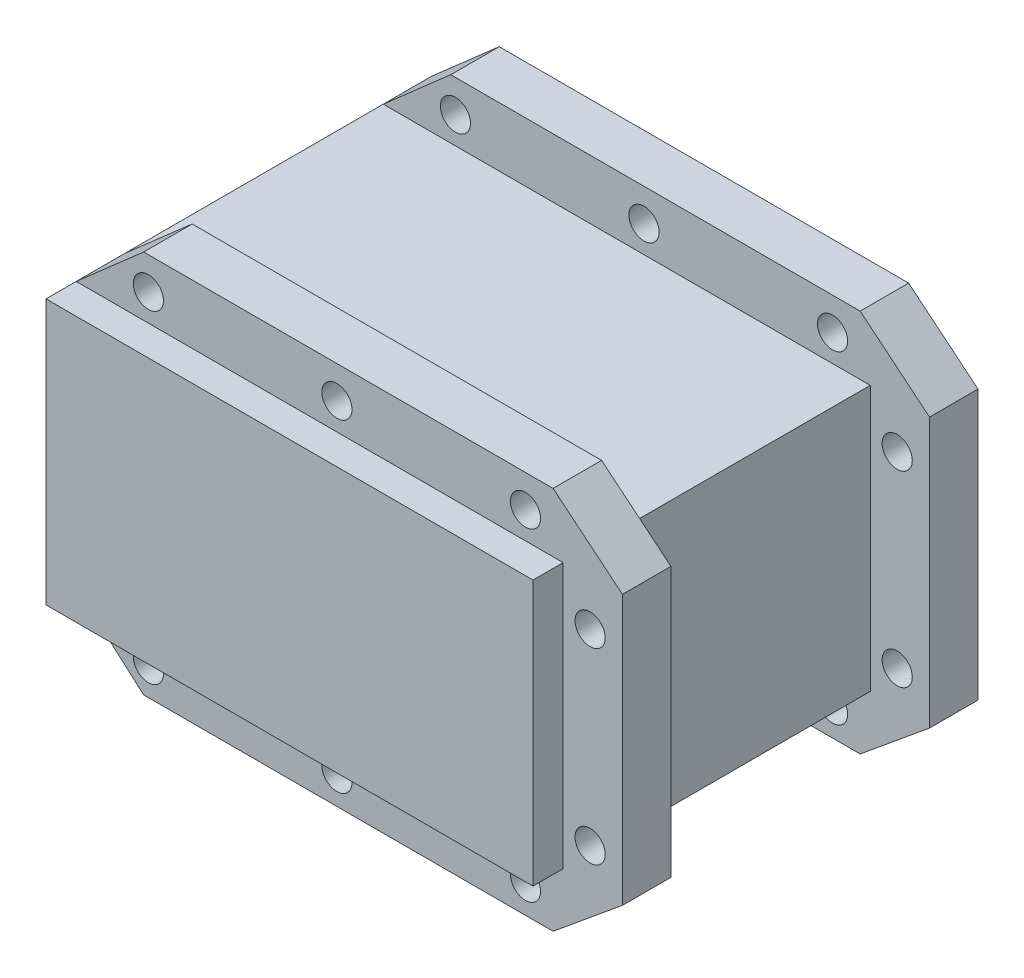
from build123d import *

# Parameters (mm, degrees)
SKETCH1_W                 = 45.2
SKETCH1_H                 = 24.6
BOSS_EXTRUDE1_DEPTH       = 35.8
BOSS_EXTRUDE2_DEPTH       = 4.5
SKETCH4_R                 = 1.4
CUT_EXTRUDE1_DEPTH        = 68.568483778
LPATTERN1_COUNT           = 3
LPATTERN1_PITCH           = 17.5
LPATTERN1_COUNT_DIR2      = 2
LPATTERN1_PITCH_DIR2      = 30
SKETCH6_R                 = 1.4
CUT_EXTRUDE2_DEPTH        = 68.568483778
LPATTERN2_COUNT           = 2
LPATTERN2_PITCH           = 28.5
LPATTERN2_COPY_1_SKETCH_R = 1.4
LPATTERN2_COPY_1_DEPTH    = 68.568483778
LPATTERN2_COPY_2_SKETCH_R = 1.4
LPATTERN2_COPY_2_DEPTH    = 68.568483778
LPATTERN2_COPY_3_SKETCH_R = 1.4
LPATTERN2_COPY_3_DEPTH    = 68.568483778
LPATTERN2_COPY_4_SKETCH_R = 1.4
LPATTERN2_COPY_4_DEPTH    = 68.568483778
LPATTERN2_COPY_5_SKETCH_R = 1.4
LPATTERN2_COPY_5_DEPTH    = 68.568483778


with BuildPart() as part:
    # Sketch1 → Boss-Extrude1 (new body)
    with BuildSketch(Plane.XY):
        with Locations((22.6, 12.3)):
            Rectangle(SKETCH1_W, SKETCH1_H)
    extrude(amount=BOSS_EXTRUDE1_DEPTH)

    # Sketch3 → Boss-Extrude2 (add)
    with BuildSketch(Plane.XY.offset(33)):
        Polygon((0, 24.6), (6.26496063, 30.1), (44.26496063, 30.1), (50.7, 24.8), (50.7, -0.2), (44.26496063, -5.5), (6.26496063, -5.5), (0, 0), (45.2, 0), (45.2, 24.6), align=None)
    boss_extrude2 = extrude(amount=-BOSS_EXTRUDE2_DEPTH)

    # Sketch4 → Cut-Extrude1 (cut, through all)
    with BuildSketch(Plane.XY.offset(33)):
        with Locations((6.7, 27.1)):
            Circle(SKETCH4_R)
    cut_extrude1 = extrude(amount=-CUT_EXTRUDE1_DEPTH, mode=Mode.SUBTRACT)

    # LPattern1: Cut-Extrude1 3 × 2
    with Locations(*[(i * LPATTERN1_PITCH, -j * LPATTERN1_PITCH_DIR2, 0) for i in range(LPATTERN1_COUNT) for j in range(LPATTERN1_COUNT_DIR2) if (i, j) != (0, 0)]):
        add(cut_extrude1, mode=Mode.SUBTRACT)

    # Sketch6 → Cut-Extrude2 (cut, through all)
    with BuildSketch(Plane.XY.offset(33)):
        with Locations((47.7, 20.5)):
            Circle(SKETCH6_R)
        with Locations((47.7, 3.1)):
            Circle(SKETCH6_R)
    cut_extrude2 = extrude(amount=-CUT_EXTRUDE2_DEPTH, mode=Mode.SUBTRACT)

    # LPattern2: Boss-Extrude2, Cut-Extrude1, Cut-Extrude2 ×2
    with Locations(*[(0, 0, -i * LPATTERN2_PITCH) for i in range(1, LPATTERN2_COUNT)]):
        add(boss_extrude2)
        add(cut_extrude1, mode=Mode.SUBTRACT)
        add(cut_extrude2, mode=Mode.SUBTRACT)

    # LPattern2 copy 1 sketch → LPattern2 copy 1 (cut, through all)
    with BuildSketch(Plane(origin=(0, -30, 4.5), x_dir=(1, 0, 0), z_dir=(0, 0, 1))):
        with Locations((6.7, 27.1)):
            Circle(LPATTERN2_COPY_1_SKETCH_R)
    extrude(amount=-LPATTERN2_COPY_1_DEPTH, mode=Mode.SUBTRACT)

    # LPattern2 copy 2 sketch → LPattern2 copy 2 (cut, through all)
    with BuildSketch(Plane(origin=(17.5, 0, 4.5), x_dir=(1, 0, 0), z_dir=(0, 0, 1))):
        with Locations((6.7, 27.1)):
            Circle(LPATTERN2_COPY_2_SKETCH_R)
    extrude(amount=-LPATTERN2_COPY_2_DEPTH, mode=Mode.SUBTRACT)

    # LPattern2 copy 3 sketch → LPattern2 copy 3 (cut, through all)
    with BuildSketch(Plane(origin=(17.5, -30, 4.5), x_dir=(1, 0, 0), z_dir=(0, 0, 1))):
        with Locations((6.7, 27.1)):
            Circle(LPATTERN2_COPY_3_SKETCH_R)
    extrude(amount=-LPATTERN2_COPY_3_DEPTH, mode=Mode.SUBTRACT)

    # LPattern2 copy 4 sketch → LPattern2 copy 4 (cut, through all)
    with BuildSketch(Plane(origin=(35, 0, 4.5), x_dir=(1, 0, 0), z_dir=(0, 0, 1))):
        with Locations((6.7, 27.1)):
            Circle(LPATTERN2_COPY_4_SKETCH_R)
    extrude(amount=-LPATTERN2_COPY_4_DEPTH, mode=Mode.SUBTRACT)

    # LPattern2 copy 5 sketch → LPattern2 copy 5 (cut, through all)
    with BuildSketch(Plane(origin=(35, -30, 4.5), x_dir=(1, 0, 0), z_dir=(0, 0, 1))):
        with Locations((6.7, 27.1)):
            Circle(LPATTERN2_COPY_5_SKETCH_R)
    extrude(amount=-LPATTERN2_COPY_5_DEPTH, mode=Mode.SUBTRACT)


solid = part.part
